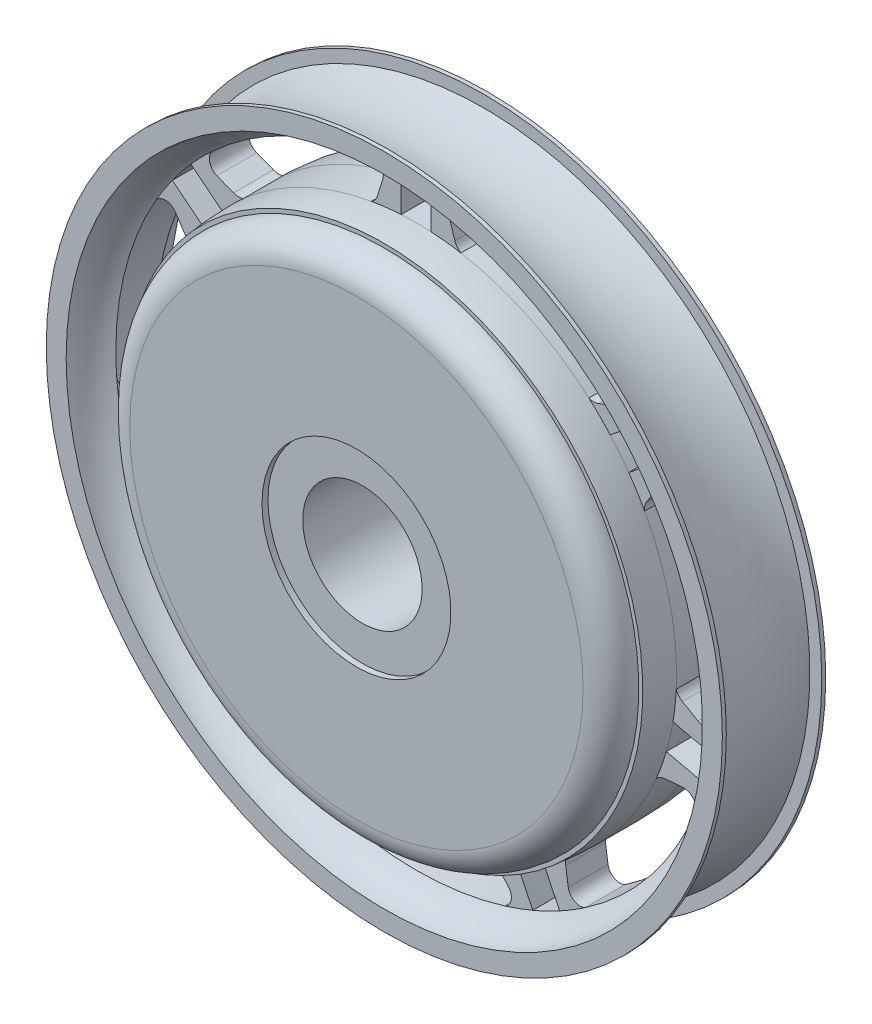
from build123d import *

# Parameters (mm, degrees)
CUT_EXTRUDE1_DEPTH      = 246.560583156
CUT_EXTRUDE1_DEPTH_BACK = 246.560583156


with BuildPart() as part:
    # Sketch2 → Revolve1 (revolve)
    with BuildSketch(Plane(origin=(0, 0, 0), x_dir=(1, 0, 0), z_dir=(0, 1, 0))):
        with BuildLine():
            Line((-47.5, -40), (-114, -40))
            ThreePointArc((-114, -40), (-123.899494937, -35.899494937), (-128, -26))
            Line((-128, -26), (-130, -26))
            ThreePointArc((-130, -26), (-130.749756335, -18.015609771), (-131, -10))
            Line((-131, -10), (-151, -10))
            ThreePointArc((-151, -10), (-157.444175053, -16.906401533), (-160, -26))
            Line((-160, -26), (-170, -26))
            Line((-170, -26), (-170, -24))
            Line((-170, -24), (-164, -24))
            ThreePointArc((-164, -24), (-158.990908339, 0), (-164, 24))
            Line((-164, 24), (-170, 24))
            Line((-170, 24), (-170, 26))
            Line((-170, 26), (-160, 26))
            ThreePointArc((-160, 26), (-157.444175053, 16.906401533), (-151, 10))
            Line((-151, 10), (-131, 10))
            ThreePointArc((-131, 10), (-130.749756335, 18.015609771), (-130, 26))
            Line((-130, 26), (-128, 26))
            ThreePointArc((-128, 26), (-123.899494937, 35.899494937), (-114, 40))
            Line((-114, 40), (-47.5, 40))
            Line((-47.5, 40), (-47.5, 37))
            Line((-47.5, 37), (-30, 37))
            Line((-30, 37), (-30, -37))
            Line((-30, -37), (-47.5, -37))
            Line((-47.5, -37), (-47.5, -40))
        make_face()
    revolve(axis=Axis((0, 0, -135.367425902), (0, 0, 1)))

    # Sketch3 → Cut-Extrude1 (cut, two sides: drawn at the far end of the back side and taken through both)
    with BuildSketch(Plane.XY.offset(10).offset(-CUT_EXTRUDE1_DEPTH_BACK)):
        with BuildLine():
            ThreePointArc((-16.775359417, 141.517465908), (-17.663637735, 146.86526576), (-22.5, 149.314265896))
            ThreePointArc((-22.5, 149.314265896), (-65.516444607, 136.046299053), (-102.710073317, 110.687130414))
            ThreePointArc((-102.710073317, 110.687130414), (-103.810790461, 105.378983525), (-100.183544647, 101.350200901))
            Line((-100.183544647, 101.350200901), (-91.789558594, 98.103510563))
            ThreePointArc((-91.789558594, 98.103510563), (-89.333916802, 97.632512022), (-86.869399468, 98.054614557))
            ThreePointArc((-86.869399468, 98.054614557), (-56.838769824, 118.026921695), (-22.5, 129.053283569))
            ThreePointArc((-22.5, 129.053283569), (-20.633385525, 130.716944184), (-19.470559398, 132.930505034))
            Line((-19.470559398, 132.930505034), (-16.775359417, 141.517465908))
        make_face()
        with BuildLine():
            Line((-97.575757874, 87.406930362), (-113.234667829, 99.894494351))
            ThreePointArc((-113.234667829, 99.894494351), (-118.056553853, 94.146960081), (-122.587014857, 88.167022114))
            Line((-122.587014857, 88.167022114), (-106.928104902, 75.679458125))
            ThreePointArc((-106.928104902, 75.679458125), (-102.419924203, 81.677164043), (-97.575757874, 87.406930362))
        make_face()
        with BuildLine():
            ThreePointArc((-121.102075685, 75.119192657), (-125.836986444, 77.759007373), (-130.767114401, 75.504713703))
            ThreePointArc((-130.767114401, 75.504713703), (-147.214114739, 33.600661027), (-150.577366523, -11.289671876))
            ThreePointArc((-150.577366523, -11.289671876), (-147.113576085, -15.459822645), (-141.70219622, -15.135832553))
            Line((-141.70219622, -15.135832553), (-133.9302668, -10.597428308))
            ThreePointArc((-133.9302668, -10.597428308), (-132.030957698, -8.971193032), (-130.824369324, -6.781179166))
            ThreePointArc((-130.824369324, -6.781179166), (-127.715556496, 29.150242348), (-114.926440552, 62.872197846))
            ThreePointArc((-114.926440552, 62.872197846), (-115.063327708, 65.368851235), (-116.068949037, 67.658117926))
            Line((-116.068949037, 67.658117926), (-121.102075685, 75.119192657))
        make_face()
        with BuildLine():
            Line((-129.174979886, -21.790469739), (-148.701321217, -26.247229726))
            ThreePointArc((-148.701321217, -26.247229726), (-147.214114739, -33.600661027), (-145.363507208, -40.871148409))
            Line((-145.363507208, -40.871148409), (-125.837165877, -36.414388422))
            ThreePointArc((-125.837165877, -36.414388422), (-127.715556496, -29.150242348), (-129.174979886, -21.790469739))
        make_face()
        with BuildLine():
            ThreePointArc((-134.23645893, -47.845364818), (-139.252517754, -49.901369561), (-140.563924495, -55.161427924))
            ThreePointArc((-140.563924495, -55.161427924), (-118.056553853, -94.146960081), (-85.056831518, -124.765120976))
            ThreePointArc((-85.056831518, -124.765120976), (-79.636838347, -124.65706704), (-76.516203841, -120.224275379))
            Line((-76.516203841, -120.224275379), (-75.218752425, -111.318287515))
            ThreePointArc((-75.218752425, -111.318287515), (-75.305994506, -108.819406755), (-76.265920748, -106.510606666))
            ThreePointArc((-76.265920748, -106.510606666), (-102.419924203, -81.677164043), (-120.810927296, -50.652935214))
            ThreePointArc((-120.810927296, -50.652935214), (-122.848237262, -49.203319975), (-125.265052676, -48.562211955))
            Line((-125.265052676, -48.562211955), (-134.23645893, -47.845364818))
        make_face()
        with BuildLine():
            Line((-63.502807355, -114.579201682), (-72.192846774, -132.624254474))
            ThreePointArc((-72.192846774, -132.624254474), (-65.516444607, -136.046299053), (-58.678313755, -139.13251056))
            Line((-58.678313755, -139.13251056), (-49.988274336, -121.087457769))
            ThreePointArc((-49.988274336, -121.087457769), (-56.838769824, -118.026921695), (-63.502807355, -114.579201682))
        make_face()
        with BuildLine():
            ThreePointArc((-46.288050676, -134.781386717), (-47.808062962, -139.984997413), (-44.513232463, -144.289889236))
            ThreePointArc((-44.513232463, -144.289889236), (0, -151), (44.513232463, -144.289889236))
            ThreePointArc((44.513232463, -144.289889236), (47.808062962, -139.984997413), (46.288050676, -134.781386717))
            Line((46.288050676, -134.781386717), (40.134016708, -128.214205744))
            ThreePointArc((40.134016708, -128.214205744), (38.125918511, -126.724387679), (35.722321693, -126.035374927))
            ThreePointArc((35.722321693, -126.035374927), (0, -131), (-35.722321693, -126.035374927))
            ThreePointArc((-35.722321693, -126.035374927), (-38.125918511, -126.724387679), (-40.134016708, -128.214205744))
            Line((-40.134016708, -128.214205744), (-46.288050676, -134.781386717))
        make_face()
        with BuildLine():
            ThreePointArc((85.056831518, -124.765120976), (118.056553853, -94.146960081), (140.563924495, -55.161427924))
            ThreePointArc((140.563924495, -55.161427924), (139.252517754, -49.901369561), (134.23645893, -47.845364818))
            Line((134.23645893, -47.845364818), (125.265052676, -48.562211955))
            ThreePointArc((125.265052676, -48.562211955), (122.848237262, -49.203319975), (120.810927296, -50.652935214))
            ThreePointArc((120.810927296, -50.652935214), (102.419924203, -81.677164043), (76.265920748, -106.510606666))
            ThreePointArc((76.265920748, -106.510606666), (75.305994506, -108.819406755), (75.218752425, -111.318287515))
            Line((75.218752425, -111.318287515), (76.516203841, -120.224275379))
            ThreePointArc((76.516203841, -120.224275379), (79.636838347, -124.65706704), (85.056831518, -124.765120976))
        make_face()
        with BuildLine():
            ThreePointArc((145.363507208, -40.871148409), (147.214114739, -33.600661027), (148.701321217, -26.247229726))
            Line((148.701321217, -26.247229726), (129.174979886, -21.790469739))
            ThreePointArc((129.174979886, -21.790469739), (127.715556496, -29.150242348), (125.837165877, -36.414388422))
            Line((125.837165877, -36.414388422), (145.363507208, -40.871148409))
        make_face()
        with BuildLine():
            ThreePointArc((151, 0), (145.854095374, 39.084304557), (130.767114401, 75.504713703))
            ThreePointArc((130.767114401, 75.504713703), (125.836986444, 77.759007373), (121.102075685, 75.119192657))
            Line((121.102075685, 75.119192657), (116.068949037, 67.658117926))
            ThreePointArc((116.068949037, 67.658117926), (115.063327708, 65.368851235), (114.926440552, 62.872197846))
            ThreePointArc((114.926440552, 62.872197846), (126.918012339, 32.447159257), (131, 0))
            ThreePointArc((131, 0), (130.95608497, -3.391726589), (130.824369324, -6.781179166))
            ThreePointArc((130.824369324, -6.781179166), (132.030957698, -8.971193032), (133.9302668, -10.597428308))
            Line((133.9302668, -10.597428308), (141.70219622, -15.135832553))
            ThreePointArc((141.70219622, -15.135832553), (147.113576085, -15.459822645), (150.577366523, -11.289671876))
            ThreePointArc((150.577366523, -11.289671876), (150.894304639, -5.648789917), (151, 0))
        make_face()
        with BuildLine():
            ThreePointArc((122.587014857, 88.167022114), (118.056553853, 94.146960081), (113.234667829, 99.894494351))
            Line((113.234667829, 99.894494351), (97.575757874, 87.406930362))
            ThreePointArc((97.575757874, 87.406930362), (102.419924203, 81.677164043), (106.928104902, 75.679458125))
            Line((106.928104902, 75.679458125), (122.587014857, 88.167022114))
        make_face()
        with BuildLine():
            ThreePointArc((102.710073317, 110.687130414), (65.516444607, 136.046299053), (22.5, 149.314265896))
            ThreePointArc((22.5, 149.314265896), (17.663637735, 146.86526576), (16.775359417, 141.517465908))
            Line((16.775359417, 141.517465908), (19.470559398, 132.930505034))
            ThreePointArc((19.470559398, 132.930505034), (20.633385525, 130.716944184), (22.5, 129.053283569))
            ThreePointArc((22.5, 129.053283569), (56.838769824, 118.026921695), (86.869399468, 98.054614557))
            ThreePointArc((86.869399468, 98.054614557), (89.333916802, 97.632512022), (91.789558594, 98.103510563))
            Line((91.789558594, 98.103510563), (100.183544647, 101.350200901))
            ThreePointArc((100.183544647, 101.350200901), (103.810790461, 105.378983525), (102.710073317, 110.687130414))
        make_face()
        with BuildLine():
            ThreePointArc((7.5, 150.813626705), (0, 151), (-7.5, 150.813626705))
            Line((-7.5, 150.813626705), (-7.5, 130.785129124))
            ThreePointArc((-7.5, 130.785129124), (0, 131), (7.5, 130.785129124))
            Line((7.5, 130.785129124), (7.5, 150.813626705))
        make_face()
        with BuildLine():
            ThreePointArc((58.678313755, -139.13251056), (65.516444607, -136.046299053), (72.192846774, -132.624254474))
            Line((72.192846774, -132.624254474), (63.502807355, -114.579201682))
            ThreePointArc((63.502807355, -114.579201682), (56.838769824, -118.026921695), (49.988274336, -121.087457769))
            Line((49.988274336, -121.087457769), (58.678313755, -139.13251056))
        make_face()
    extrude(amount=CUT_EXTRUDE1_DEPTH + CUT_EXTRUDE1_DEPTH_BACK, mode=Mode.SUBTRACT)


solid = part.part
